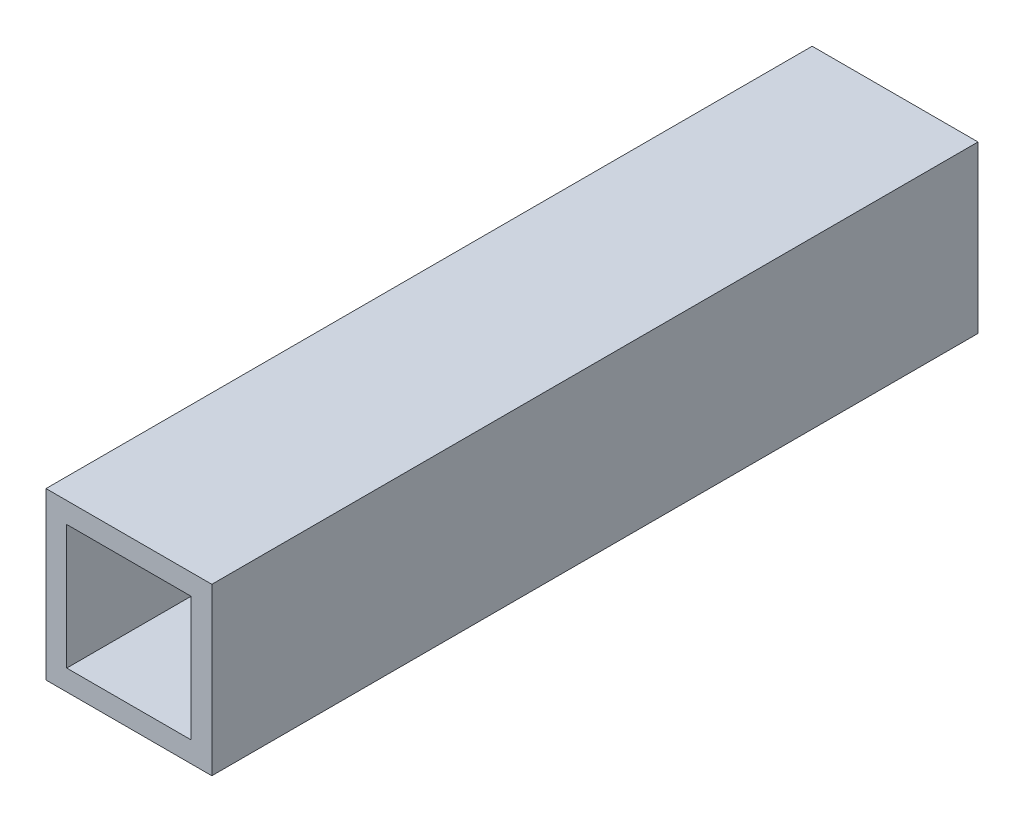
from build123d import *

# Parameters (mm, degrees)
BOSS_EXTRUDE1_DEPTH      = 58.674
BOSS_EXTRUDE1_DEPTH_BACK = 58.674
SKETCH3_W                = 25.4
SKETCH3_H                = 25.4
SKETCH3_W_2              = 19.05
SKETCH3_H_2              = 19.05


with BuildPart() as part:
    # Sketch3 → Boss-Extrude1 (new, two sides: drawn at the far end of the back side and taken through both)
    with BuildSketch(Plane.XY.offset(-BOSS_EXTRUDE1_DEPTH_BACK)):
        Rectangle(SKETCH3_W, SKETCH3_H)
        Rectangle(SKETCH3_W_2, SKETCH3_H_2, mode=Mode.SUBTRACT)
    extrude(amount=BOSS_EXTRUDE1_DEPTH + BOSS_EXTRUDE1_DEPTH_BACK)


solid = part.part
